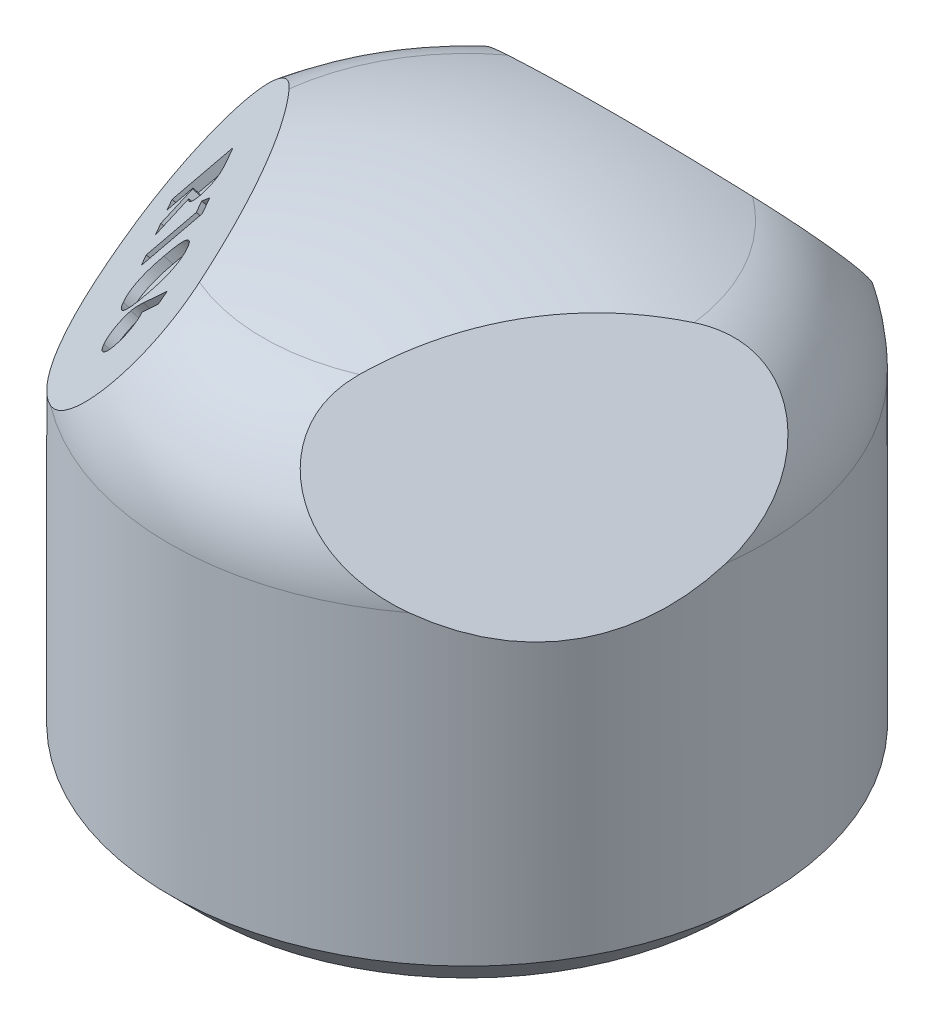
from build123d import *

# Parameters (mm, degrees)
VERRUNDUNG1_R                   = 8
SCHNITT_LINEAR_AUSTRAGEN2_DEPTH = 39.444765662
KREISMUSTER3_COUNT              = 3
SCHNITT_LINEAR_AUSTRAGEN3_DEPTH = 0.5
SKIZZE12_R                      = 0.936709894
SKIZZE12_R_2                    = 0.949630641
SKIZZE12_RX                     = 1.626255754
SKIZZE12_RY                     = 1.054911958
SCHNITT_LINEAR_AUSTRAGEN4_DEPTH = 0.5


with BuildPart() as part:
    # Skizze1 → Rotation1 (revolve)
    with BuildSketch(Plane.XY, mode=Mode.PRIVATE) as rotation1_sk:
        with BuildLine():
            Line((0, 30), (0, 0))
            ThreePointArc((0, 0), (7.518939802, 0.267008251), (15, 1.066687844))
            Line((15, 1.066687844), (17, 3.066687844))
            Line((17, 3.066687844), (17, 25.594117082))
            ThreePointArc((17, 25.594117082), (8.78082861, 28.880629406), (0, 30))
        make_face()
    revolve(rotation1_sk.sketch.rotate(Axis((0, 0, 0), (0, 1, 0)), 90), axis=Axis((0, 0, 0), (0, 1, 0)))

    # Verrundung1
    verrundung1_edges = [part.edges().sort_by_distance(p)[0] for p in [
        (0, 25.594117082, 17),
    ]]
    fillet(verrundung1_edges, radius=VERRUNDUNG1_R)

    # Skizze10 → Schnitt-Linear austragen2 (cut, symmetric)
    with BuildSketch(Plane(origin=(0, 0, 0), x_dir=(0, -1, 0), z_dir=(-1, 0, 0))):
        Polygon((-30.098973224, -7.563276754), (-17.760700281, -17.91631703), (-30.098973224, -17.91631703), align=None)
    schnitt_linear_austragen2 = extrude(amount=SCHNITT_LINEAR_AUSTRAGEN2_DEPTH, both=True, mode=Mode.SUBTRACT)

    # Kreismuster3: Schnitt-Linear austragen2 ×3 about axis
    kreismuster3_axis = Axis((0, 0, 0), (0, 1, 0))
    for i in range(1, KREISMUSTER3_COUNT):
        add(schnitt_linear_austragen2.rotate(kreismuster3_axis, i * 360 / KREISMUSTER3_COUNT), mode=Mode.SUBTRACT)

    # Skizze11 → Schnitt-Linear austragen3 (cut)
    # profile 1 of 4: a face of its own
    with BuildSketch(Plane(origin=(-46.691900407, -25.141053182, 26.957581269), x_dir=(-0.23209070726491374, -0.6634139481689453, 0.7113479015054196), z_dir=(0.6634139481689454, -0.6427876096865346, -0.38302222155948495))):
        with BuildLine():
            Line((-55.068769207, -37.328614289), (-54.464449646, -37.721004669))
            Line((-54.464449646, -37.721004669), (-53.64921246, -36.435575009))
            add(Edge.make_bspline(
                [(-53.64921246, -36.435575009), (-53.627258876, -36.470618614), (-53.583912664, -36.539810391), (-53.508902201, -36.635086845), (-53.42611742, -36.720457033), (-53.334891933, -36.794793127), (-53.237672235, -36.860925647), (-53.131955592, -36.915737652), (-53.019440085, -36.961277683), (-52.900712789, -36.996411889), (-52.779070207, -37.02112928), (-52.656497992, -37.033196228), (-52.534929837, -37.032822824), (-52.413992924, -37.02096826), (-52.294469972, -36.994968727), (-52.176143156, -36.956936345), (-52.057884236, -36.9084163), (-51.982558763, -36.866082647), (-51.944147319, -36.84449504)],
                knots=[0, 0, 0, 0, 1.014814967, 2.003699405, 2.97121477, 3.928630626, 4.888379676, 5.853246352, 6.846578942, 7.864631034, 8.889147683, 9.890007506, 10.883253494, 11.869786448, 12.868129139, 13.880142973, 14.919000884, 16, 16, 16, 16], degree=3))
            add(Edge.make_bspline(
                [(-51.944147319, -36.84449504), (-51.907824679, -36.822098668), (-51.836481504, -36.778108795), (-51.738968809, -36.700975135), (-51.652172979, -36.616046078), (-51.5737966, -36.524820971), (-51.506288414, -36.425392242), (-51.449501405, -36.31838566), (-51.402419386, -36.204600255), (-51.365751352, -36.084902613), (-51.339742769, -35.96260413), (-51.325844744, -35.840207234), (-51.323819948, -35.719693), (-51.334255249, -35.600596721), (-51.357948318, -35.483477168), (-51.392100358, -35.367444278), (-51.439853893, -35.253721547), (-51.479761119, -35.180918087), (-51.499965235, -35.144059359)],
                knots=[0, 0, 0, 0, 1.046405671, 2.055299484, 3.042851383, 4.02236788, 5.001533515, 5.985141422, 6.989897173, 8.018522185, 9.05270664, 10.053543279, 11.03638671, 12.005499406, 12.980841278, 13.963684708, 14.969060118, 16, 16, 16, 16], degree=3))
            add(Edge.make_bspline(
                [(-51.499965235, -35.144059359), (-51.523260973, -35.106612726), (-51.569047742, -35.033012985), (-51.648514708, -34.932280289), (-51.735845251, -34.843169302), (-51.829108732, -34.763410993), (-51.930998661, -34.695819548), (-52.039549448, -34.638206779), (-52.156260109, -34.593258553), (-52.277636789, -34.557553807), (-52.401557636, -34.534236076), (-52.524053989, -34.52058481), (-52.644111841, -34.519031816), (-52.761395681, -34.52948216), (-52.876086515, -34.550201934), (-52.987582768, -34.584296189), (-53.096957737, -34.628225439), (-53.166349661, -34.666278897), (-53.201330606, -34.685461906)],
                knots=[0, 0, 0, 0, 1.08088391, 2.124430682, 3.138370206, 4.136618536, 5.127794036, 6.130672843, 7.144041031, 8.189312948, 9.229132719, 10.231990138, 11.208514985, 12.16791057, 13.115609064, 14.060814623, 15.022443337, 16, 16, 16, 16], degree=3))
            add(Edge.make_bspline(
                [(-53.201330606, -34.685461906), (-53.227527065, -34.701514871), (-53.28017745, -34.733778574), (-53.354074801, -34.79108993), (-53.426134248, -34.852660737), (-53.483600507, -34.910170493), (-53.5294221, -34.962142028), (-53.5670989, -35.008294344), (-53.607914524, -35.061569697), (-53.651881514, -35.121960627), (-53.699123622, -35.18938431), (-53.749486055, -35.263953059), (-53.803075963, -35.345595094), (-53.839417861, -35.402673241), (-53.858229803, -35.432219051)],
                knots=[0, 0, 0, 0, 1.099750808, 2.210310339, 3.344964319, 4.493728859, 5.118546223, 5.826339277, 6.627376285, 7.522272725, 8.50193817, 9.576216146, 10.745357722, 12, 12, 12, 12], degree=3))
            Line((-53.858229803, -35.432219051), (-55.068769207, -37.328614289))
        make_face()
        with BuildLine():
            add(Edge.make_bspline(
                [(-53.052593843, -36.035214071), (-53.068248757, -36.004983358), (-53.098807517, -35.945972295), (-53.121359508, -35.848903172), (-53.12255667, -35.749951347), (-53.102740929, -35.651084146), (-53.064976933, -35.555736661), (-53.007132134, -35.469692524), (-52.932660704, -35.393672325), (-52.872422836, -35.354641125), (-52.841455469, -35.334575783)],
                knots=[0, 0, 0, 0, 0.997996255, 1.948112127, 2.899104146, 3.887691138, 4.895161864, 5.894640567, 6.917666915, 8, 8, 8, 8], degree=3))
            add(Edge.make_bspline(
                [(-52.841455469, -35.334575783), (-52.808769867, -35.317233867), (-52.745129296, -35.283468253), (-52.64112257, -35.256868371), (-52.536067526, -35.250772013), (-52.431980708, -35.264990105), (-52.334370626, -35.297674222), (-52.246551247, -35.345071033), (-52.173560498, -35.410691807), (-52.137673723, -35.46433437), (-52.119604264, -35.491344101)],
                knots=[0, 0, 0, 0, 1.080547902, 2.103883106, 3.114945784, 4.146351884, 5.160436275, 6.114929871, 7.050842583, 8, 8, 8, 8], degree=3))
            add(Edge.make_bspline(
                [(-52.119604264, -35.491344101), (-52.103584572, -35.521674445), (-52.072143102, -35.581203094), (-52.050719971, -35.680206425), (-52.047454285, -35.781501233), (-52.067050338, -35.883303536), (-52.102215292, -35.982285303), (-52.160267739, -36.070937766), (-52.234950831, -36.1496759), (-52.296540793, -36.18955674), (-52.328239147, -36.210082115)],
                knots=[0, 0, 0, 0, 0.983838845, 1.930957232, 2.887558075, 3.885315493, 4.899663139, 5.893170145, 6.915683032, 8, 8, 8, 8], degree=3))
            add(Edge.make_bspline(
                [(-52.328239147, -36.210082115), (-52.360941192, -36.227381434), (-52.424445919, -36.260975313), (-52.527795964, -36.288123803), (-52.631803318, -36.29502171), (-52.734441854, -36.279674457), (-52.831670409, -36.246296754), (-52.919356615, -36.193971742), (-52.995044569, -36.123092157), (-53.033090819, -36.064995305), (-53.052593843, -36.035214071)],
                knots=[0, 0, 0, 0, 1.064114286, 2.066423941, 3.055681589, 4.051337622, 5.039454777, 6.002539922, 6.97607487, 8, 8, 8, 8], degree=3))
        make_face(mode=Mode.SUBTRACT)
    # profile 2 of 4: a face of its own
    with BuildSketch(Plane(origin=(-46.691900407, -25.141053182, 26.957581269), x_dir=(-0.23209070726491374, -0.6634139481689453, 0.7113479015054196), z_dir=(0.6634139481689454, -0.6427876096865346, -0.38302222155948495))):
        with BuildLine():
            add(Edge.make_bspline(
                [(-56.641754688, -34.605128218), (-56.623141062, -34.635490283), (-56.586336603, -34.695524768), (-56.525049, -34.779623805), (-56.460017197, -34.85715754), (-56.39169074, -34.928611848), (-56.318837449, -34.99277985), (-56.241830413, -35.050219819), (-56.161466592, -35.101200323), (-56.077557834, -35.146136472), (-55.989729152, -35.183928573), (-55.897693529, -35.213924506), (-55.801491007, -35.23553183), (-55.701851673, -35.250606871), (-55.598395356, -35.257911688), (-55.491291712, -35.258862479), (-55.380192723, -35.250994642), (-55.264530336, -35.236200013), (-55.143750313, -35.211565954), (-55.016625003, -35.178539545), (-54.883890847, -35.132875293), (-54.743410491, -35.080205645), (-54.597555298, -35.014819515), (-54.444254942, -34.941402958), (-54.285572588, -34.855868651), (-54.17811595, -34.794622875), (-54.122878354, -34.763139764)],
                knots=[0, 0, 0, 0, 0.894845406, 1.769365235, 2.612478441, 3.436862169, 4.251816518, 5.04952845, 5.84910255, 6.641713608, 7.43942554, 8.249165016, 9.070947942, 9.914915961, 10.77964115, 11.675593851, 12.60468534, 13.57680024, 14.604290727, 15.700844141, 16.875498399, 18.130505309, 19.470538809, 20.891230622, 22.401951269, 24, 24, 24, 24], degree=3))
            add(Edge.make_bspline(
                [(-54.122878354, -34.763139764), (-54.067636908, -34.730197502), (-53.960375066, -34.666233797), (-53.807762802, -34.566805463), (-53.666775889, -34.469409663), (-53.538811678, -34.371402039), (-53.422857332, -34.274739961), (-53.318150325, -34.179965812), (-53.227060334, -34.084643795), (-53.147181495, -33.990471124), (-53.078382258, -33.896243991), (-53.017218593, -33.803416354), (-52.963332221, -33.711468824), (-52.919605446, -33.61894565), (-52.88331597, -33.52736777), (-52.854476377, -33.436460864), (-52.834618652, -33.345488835), (-52.822887454, -33.254640628), (-52.819895203, -33.163799948), (-52.823770886, -33.072155978), (-52.837603842, -32.979957418), (-52.857287026, -32.886229519), (-52.887294927, -32.792709369), (-52.92381121, -32.697629321), (-52.968671306, -32.601815757), (-53.004150706, -32.539091499), (-53.022152022, -32.507266857)],
                knots=[0, 0, 0, 0, 1.62422371, 3.153741207, 4.599196717, 5.950903159, 7.222830229, 8.411140517, 9.515477402, 10.550211927, 11.527550152, 12.460000237, 13.357159648, 14.216497331, 15.041691854, 15.843591073, 16.622257743, 17.390215323, 18.153656516, 18.915217933, 19.703265592, 20.5055052, 21.331361158, 22.180471436, 23.076818984, 24, 24, 24, 24], degree=3))
            add(Edge.make_bspline(
                [(-53.022152022, -32.507266857), (-53.041520882, -32.475978034), (-53.079448219, -32.414709495), (-53.14049812, -32.327672155), (-53.206681645, -32.249245601), (-53.275027655, -32.17687297), (-53.347242091, -32.111726912), (-53.423161126, -32.054487151), (-53.501561489, -32.002725312), (-53.584469893, -31.960382393), (-53.669954726, -31.923120484), (-53.760076271, -31.895455687), (-53.85294392, -31.872450786), (-53.950123359, -31.858131936), (-54.050616502, -31.849670926), (-54.155007505, -31.849400014), (-54.263171914, -31.854461784), (-54.375616023, -31.867779442), (-54.493688526, -31.889105295), (-54.6178967, -31.921568276), (-54.748646324, -31.965155928), (-54.88746949, -32.01617441), (-55.03189193, -32.080860612), (-55.184485745, -32.153338652), (-55.343022147, -32.238212772), (-55.450246159, -32.299411094), (-55.505465306, -32.330927533)],
                knots=[0, 0, 0, 0, 0.935835316, 1.832515803, 2.700724613, 3.543310519, 4.362657575, 5.170662857, 5.959685546, 6.748386526, 7.53533041, 8.328116137, 9.142718881, 9.966446904, 10.823314483, 11.705468668, 12.619301207, 13.575741633, 14.582938952, 15.668518799, 16.837380681, 18.087207693, 19.428169872, 20.860106149, 22.382990376, 24, 24, 24, 24], degree=3))
            add(Edge.make_bspline(
                [(-55.505465306, -32.330927533), (-55.581004131, -32.376692565), (-55.726735155, -32.464983387), (-55.931848249, -32.60214885), (-56.114279699, -32.740111321), (-56.275804601, -32.87704361), (-56.416023965, -33.013596088), (-56.532987654, -33.151096218), (-56.631760734, -33.286243589), (-56.680410871, -33.381513557), (-56.703896013, -33.42750374)],
                knots=[0, 0, 0, 0, 1.287176015, 2.483245918, 3.594518051, 4.618923505, 5.568093922, 6.443094887, 7.248426835, 8, 8, 8, 8], degree=3))
            add(Edge.make_bspline(
                [(-56.703896013, -33.42750374), (-56.724980471, -33.476969008), (-56.766231378, -33.573745841), (-56.806425968, -33.723751522), (-56.829131662, -33.872739178), (-56.829168662, -34.021362003), (-56.812430227, -34.169620462), (-56.775462258, -34.316995635), (-56.71916104, -34.463887768), (-56.667986813, -34.557263448), (-56.641754688, -34.605128218)],
                knots=[0, 0, 0, 0, 1.047887956, 2.050151171, 3.020662672, 3.979790842, 4.940658421, 5.924603679, 6.936143062, 8, 8, 8, 8], degree=3))
        make_face()
        with BuildLine():
            add(Edge.make_bspline(
                [(-56.010182722, -34.256405793), (-56.024889293, -34.228645805), (-56.053778672, -34.17411448), (-56.078154156, -34.084842278), (-56.087106527, -33.993111004), (-56.081855304, -33.914586603), (-56.066814021, -33.851173693), (-56.050618491, -33.801766261), (-56.027883641, -33.751643617), (-55.999252185, -33.700715222), (-55.964606411, -33.648970306), (-55.923745214, -33.596673329), (-55.878024981, -33.542673973), (-55.825729461, -33.487911082), (-55.765916147, -33.431725125), (-55.698054703, -33.373307071), (-55.62094923, -33.312592019), (-55.5348974, -33.250267506), (-55.440604901, -33.184914046), (-55.337471608, -33.117318334), (-55.225343297, -33.047776759), (-55.147184666, -33.001245373), (-55.107015637, -32.977330924)],
                knots=[0, 0, 0, 0, 1.078403696, 2.118400898, 3.159128978, 4.240349375, 4.807333096, 5.398606716, 6.026941569, 6.697994634, 7.407241907, 8.167708229, 8.980792262, 9.841328612, 10.771911779, 11.803876105, 12.921861337, 14.148179783, 15.459786029, 16.869737689, 18.391225723, 20, 20, 20, 20], degree=3))
            add(Edge.make_bspline(
                [(-55.107015637, -32.977330924), (-55.054573615, -32.947224173), (-54.953806028, -32.889373913), (-54.805764111, -32.811933565), (-54.667105056, -32.747080792), (-54.538700315, -32.693398421), (-54.419714995, -32.651737873), (-54.30994192, -32.624600671), (-54.210230832, -32.60618136), (-54.118816101, -32.602995101), (-54.035774856, -32.608885313), (-53.959333014, -32.62284108), (-53.889254029, -32.643910118), (-53.824251209, -32.6711701), (-53.766141961, -32.707785009), (-53.714454088, -32.751764728), (-53.66814141, -32.802532671), (-53.643343169, -32.841219329), (-53.630688161, -32.860961856)],
                knots=[0, 0, 0, 0, 1.764483939, 3.390464009, 4.873757228, 6.230035207, 7.450839658, 8.547717335, 9.527710337, 10.403473086, 11.208729836, 11.953227627, 12.665958967, 13.340775266, 14.003693595, 14.661090576, 15.316729437, 16, 16, 16, 16], degree=3))
            add(Edge.make_bspline(
                [(-53.630688161, -32.860961856), (-53.620059493, -32.880685499), (-53.598997867, -32.919769604), (-53.577964102, -32.982163331), (-53.565540039, -33.045570909), (-53.562584799, -33.11019306), (-53.568995034, -33.176236502), (-53.58616813, -33.242902304), (-53.609870691, -33.311524948), (-53.633151977, -33.355384616), (-53.645215566, -33.378111238)],
                knots=[0, 0, 0, 0, 0.987744162, 1.957300455, 2.893584847, 3.832390722, 4.803451815, 5.810989065, 6.865727263, 8, 8, 8, 8], degree=3))
            add(Edge.make_bspline(
                [(-53.645215566, -33.378111238), (-53.662579289, -33.407009879), (-53.698871483, -33.467411393), (-53.769117421, -33.554209827), (-53.853810179, -33.642350686), (-53.95300296, -33.73320209), (-54.067229542, -33.825192737), (-54.197912994, -33.917307784), (-54.341409995, -34.014120498), (-54.444641809, -34.075301668), (-54.498127316, -34.107000287)],
                knots=[0, 0, 0, 0, 0.713076844, 1.490413333, 2.357236127, 3.299772355, 4.336284427, 5.459958048, 6.683977112, 8, 8, 8, 8], degree=3))
            add(Edge.make_bspline(
                [(-54.498127316, -34.107000287), (-54.552542089, -34.138460316), (-54.657061073, -34.198888214), (-54.81096792, -34.27952452), (-54.954591711, -34.347544617), (-55.087892619, -34.40362124), (-55.210626711, -34.447743493), (-55.323502593, -34.478726835), (-55.425860755, -34.49864655), (-55.519180153, -34.503870077), (-55.603437198, -34.498896041), (-55.680935189, -34.487563826), (-55.751955406, -34.467897594), (-55.81698053, -34.441040471), (-55.875450522, -34.40633853), (-55.927807915, -34.36438262), (-55.972726538, -34.313617946), (-55.997542998, -34.275712239), (-56.010182722, -34.256405793)],
                knots=[0, 0, 0, 0, 1.793856826, 3.445610143, 4.957627073, 6.32836165, 7.571986161, 8.677068266, 9.66685279, 10.542220622, 11.336595378, 12.072759989, 12.773535425, 13.434491793, 14.074905435, 14.707833939, 15.34186335, 16, 16, 16, 16], degree=3))
        make_face(mode=Mode.SUBTRACT)
    # profile 3 of 4: a face of its own
    with BuildSketch(Plane(origin=(-46.691900407, -25.141053182, 26.957581269), x_dir=(-0.23209070726491374, -0.6634139481689453, 0.7113479015054196), z_dir=(0.6634139481689454, -0.6427876096865346, -0.38302222155948495))):
        Polygon((-58.411041326, -31.348248289), (-57.83686082, -32.326494889), (-54.402091295, -30.311594433), (-54.78313517, -29.662286911), (-57.604668214, -31.316953704), (-58.0195421, -30.609254302), align=None)
    # profile 4 of 4: a face of its own
    with BuildSketch(Plane(origin=(-46.691900407, -25.141053182, 26.957581269), x_dir=(-0.23209070726491374, -0.6634139481689453, 0.7113479015054196), z_dir=(0.6634139481689454, -0.6427876096865346, -0.38302222155948495))):
        with BuildLine():
            Line((-60.231888444, -28.199460786), (-59.824804968, -28.893409984))
            add(Edge.make_bspline(
                [(-59.824804968, -28.893409984), (-59.797568041, -28.938967273), (-59.745135593, -29.026667335), (-59.666411788, -29.151395671), (-59.589059289, -29.263127777), (-59.516378722, -29.363998288), (-59.44602132, -29.452526337), (-59.377345423, -29.527830853), (-59.313314775, -29.592852804), (-59.230708598, -29.661424188), (-59.123571277, -29.729447136), (-58.985314628, -29.788749544), (-58.837031097, -29.825113695), (-58.707705916, -29.837007027), (-58.601612113, -29.836872181), (-58.520797498, -29.829045539), (-58.440121212, -29.815606533), (-58.359226806, -29.796368804), (-58.278467985, -29.770626351), (-58.198047592, -29.73789488), (-58.116715376, -29.701100224), (-58.064432434, -29.671052106), (-58.037927447, -29.655819125)],
                knots=[0, 0, 0, 0, 1.423577701, 2.74045834, 3.954839113, 5.067677938, 6.074707129, 6.98540467, 7.800316329, 8.519884915, 9.860688854, 11.188165098, 12.537210589, 13.938132555, 14.660548111, 15.380045379, 16.112898561, 16.852720834, 17.608294168, 18.383611018, 19.180566951, 20, 20, 20, 20], degree=3))
            add(Edge.make_bspline(
                [(-58.037927447, -29.655819125), (-58.010536143, -29.639200072), (-57.956651633, -29.606506865), (-57.882204076, -29.551223049), (-57.812349986, -29.495160247), (-57.75099436, -29.433931466), (-57.694186793, -29.371132548), (-57.645909316, -29.303786026), (-57.602590934, -29.234468822), (-57.566242114, -29.161892885), (-57.536788736, -29.08589389), (-57.512077579, -29.007287779), (-57.495718001, -28.924752572), (-57.485292457, -28.839591753), (-57.480906378, -28.751256439), (-57.484256894, -28.660221358), (-57.492535682, -28.56557199), (-57.503664496, -28.50205119), (-57.509368387, -28.469494645)],
                knots=[0, 0, 0, 0, 1.098617958, 2.161214731, 3.179086038, 4.168507867, 5.131824876, 6.081090929, 7.007069552, 7.934271725, 8.860930298, 9.801263244, 10.757580581, 11.743090292, 12.743149556, 13.788375175, 14.866467948, 16, 16, 16, 16], degree=3))
            Line((-57.509368387, -28.469494645), (-55.505540099, -28.386582753))
            Line((-55.505540099, -28.386582753), (-55.924362865, -27.6729025))
            Line((-55.924362865, -27.6729025), (-57.832863777, -27.752561507))
            Line((-57.832863777, -27.752561507), (-57.868374939, -27.692273773))
            Line((-57.868374939, -27.692273773), (-56.413514026, -26.83904742))
            Line((-56.413514026, -26.83904742), (-56.79711892, -26.184560329))
            Line((-56.79711892, -26.184560329), (-60.231888444, -28.199460786))
        make_face()
        with BuildLine():
            Line((-58.506121401, -28.066113816), (-58.385580893, -28.27079307))
            add(Edge.make_bspline(
                [(-58.385580893, -28.27079307), (-58.370868016, -28.295898486), (-58.342591108, -28.344148977), (-58.30692656, -28.416280967), (-58.27545654, -28.482824447), (-58.251210613, -28.545311643), (-58.232205638, -28.602951909), (-58.220566505, -28.656299493), (-58.213091518, -28.704910005), (-58.213975554, -28.76319223), (-58.228440684, -28.832039146), (-58.269617769, -28.907308223), (-58.33405901, -28.973710687), (-58.387718892, -29.008810743), (-58.416281893, -29.027494402)],
                knots=[0, 0, 0, 0, 1.200949495, 2.308123545, 3.32082373, 4.238732187, 5.073963016, 5.823161674, 6.491466435, 7.098762261, 8.221694289, 9.357974521, 10.593657425, 12, 12, 12, 12], degree=3))
            add(Edge.make_bspline(
                [(-58.416281893, -29.027494402), (-58.434739867, -29.037697247), (-58.47061508, -29.057527658), (-58.52872124, -29.075470529), (-58.586970034, -29.08494724), (-58.645318733, -29.084307776), (-58.70240465, -29.076133469), (-58.756647643, -29.057029083), (-58.809135567, -29.032148139), (-58.850141444, -29.002855244), (-58.882131668, -28.973117125), (-58.908235967, -28.945003027), (-58.93603944, -28.911009199), (-58.965909525, -28.871428774), (-58.997911104, -28.826254127), (-59.031414307, -28.775064167), (-59.0671532, -28.718620471), (-59.090807338, -28.678589557), (-59.103094968, -28.657794672)],
                knots=[0, 0, 0, 0, 1.132902488, 2.201927284, 3.25535927, 4.298927443, 5.332537677, 6.345121762, 7.383125258, 8.452150054, 9.041815249, 9.733352458, 10.516086396, 11.405568793, 12.403025778, 13.496442111, 14.699475205, 16, 16, 16, 16], degree=3))
            Line((-59.103094968, -28.657794672), (-59.208641235, -28.478426682))
            Line((-59.208641235, -28.478426682), (-58.506121401, -28.066113816))
        make_face(mode=Mode.SUBTRACT)
    extrude(amount=SCHNITT_LINEAR_AUSTRAGEN3_DEPTH, mode=Mode.SUBTRACT)

    # Skizze12 → Schnitt-Linear austragen4 (cut)
    with BuildSketch(Plane(origin=(-16.678925353, 16.16035748, 9.629582042), x_dir=(0.27508013503085244, -0.26652756240166087, 0.9237391286459814), z_dir=(-0.6634139481689454, 0.6427876096865345, 0.38302222155948495))):
        with Locations((-8.26510143, 8.884193485)):
            Circle(SKIZZE12_R)
        with Locations((1.016741851, 10.527052337)):
            Circle(SKIZZE12_R_2)
        with Locations(Location((-1.949474121, 10.218281051), (0, 0, -69.034288159))):
            Ellipse(SKIZZE12_RX, SKIZZE12_RY)
    extrude(amount=-SCHNITT_LINEAR_AUSTRAGEN4_DEPTH, mode=Mode.SUBTRACT)


solid = part.part
